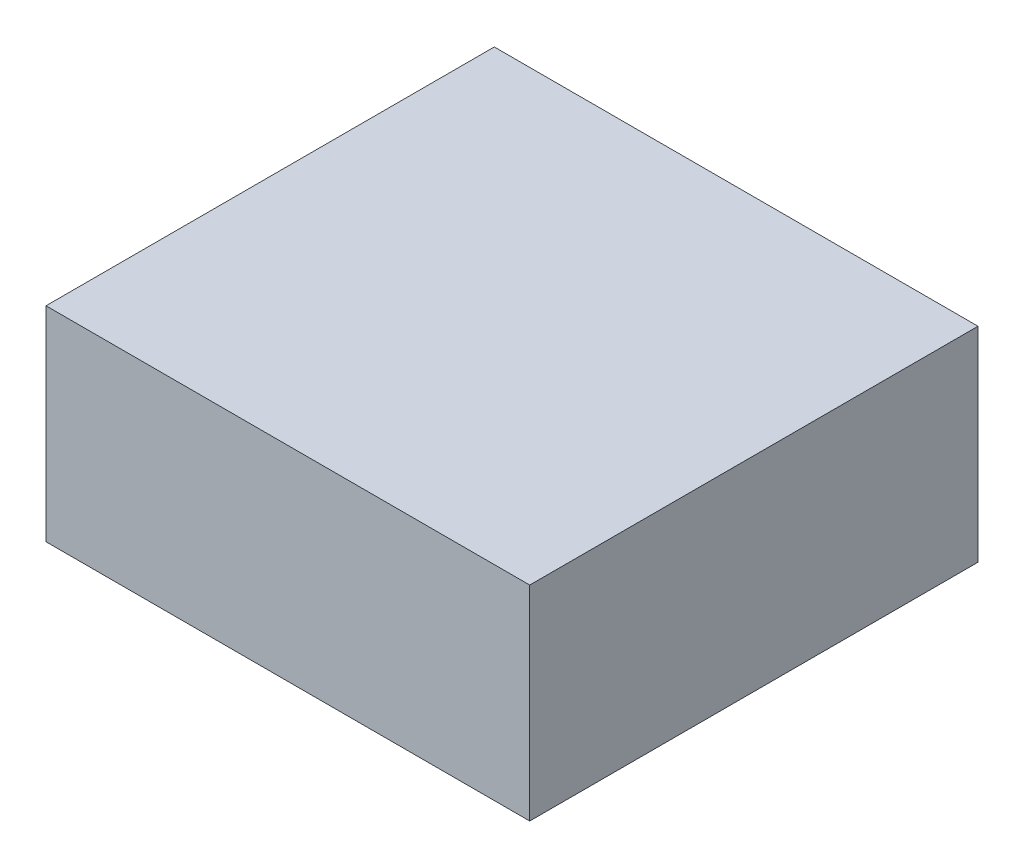
from build123d import *

# Parameters (mm, degrees)
SKETCH1_W           = 180.34
SKETCH1_H           = 167.132
BOSS_EXTRUDE1_DEPTH = 76.2


with BuildPart() as part:
    # Sketch1 → Boss-Extrude1 (new body)
    with BuildSketch(Plane(origin=(0, 0, 0), x_dir=(1, 0, 0), z_dir=(0, 1, 0))):
        with Locations((-90.17, 83.566)):
            Rectangle(SKETCH1_W, SKETCH1_H)
    extrude(amount=BOSS_EXTRUDE1_DEPTH)


solid = part.part
